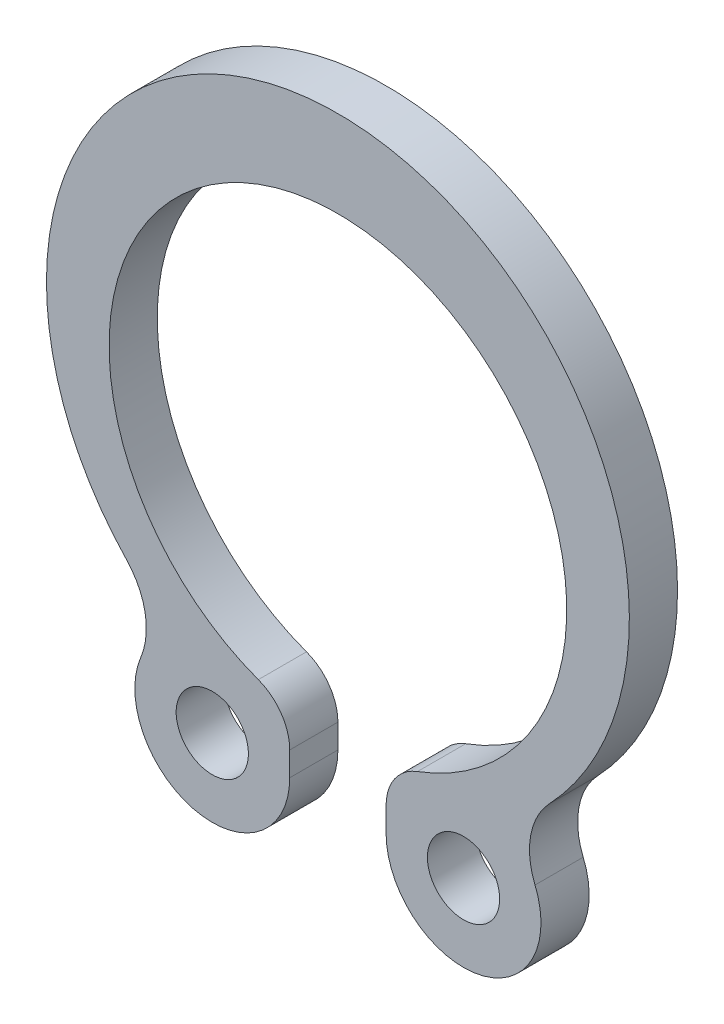
from build123d import *

# Parameters (mm, degrees)
SKETCH_10_165_R      = 0.75
EXTRUDE_10_165_DEPTH = 1


with BuildPart() as part:
    # Эскиз10-165 → Бобышка10-165 (new body)
    with BuildSketch(Plane.XY):
        with BuildLine():
            Line((-1, -5.390964663), (-1, -5.890964663))
            ThreePointArc((-1, -5.890964663), (-2.922657813, -7.467489248), (-4.091942964, -5.273220561))
            ThreePointArc((-4.091942964, -5.273220561), (-4.001670953, -4.424776755), (-4.388685631, -3.66436531))
            ThreePointArc((-4.388685631, -3.66436531), (0, 6.55), (4.388685631, -3.66436531))
            ThreePointArc((4.388685631, -3.66436531), (4.001670953, -4.424776755), (4.091942964, -5.273220561))
            ThreePointArc((4.091942964, -5.273220561), (2.922657813, -7.467489248), (1, -5.890964663))
            Line((1, -5.890964663), (1, -5.390964663))
            ThreePointArc((1, -5.390964663), (1.179077931, -4.819924422), (1.652173913, -4.453405591))
            ThreePointArc((1.652173913, -4.453405591), (0, 4.75), (-1.652173913, -4.453405591))
            ThreePointArc((-1.652173913, -4.453405591), (-1.179077931, -4.819924422), (-1, -5.390964663))
        make_face()
        with Locations((-2.60768151, -5.890964663)):
            Circle(SKETCH_10_165_R, mode=Mode.SUBTRACT)
        with Locations(Location((2.60768151, -5.890964663, 0), (0, 0, 180))):
            Circle(SKETCH_10_165_R, mode=Mode.SUBTRACT)
    extrude(amount=EXTRUDE_10_165_DEPTH)


solid = part.part
